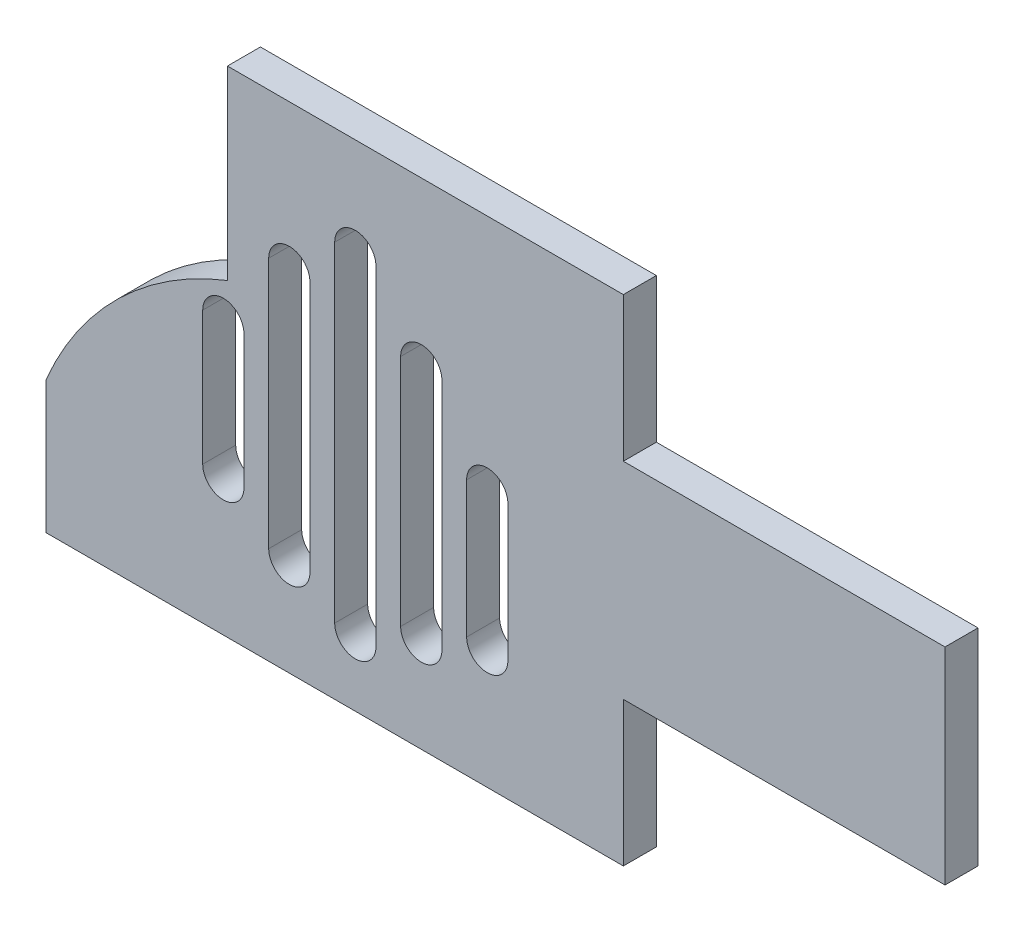
from build123d import *

# Parameters (mm, degrees)
BOSS_EXTRUDE1_DEPTH = 4


with BuildPart() as part:
    # Sketch1 → Boss-Extrude1 (new body)
    with BuildSketch(Plane.XY):
        with BuildLine():
            Line((30.862718171, 33.494054131), (69.862718171, 33.494054131))
            Line((69.862718171, 33.494054131), (69.862718171, 8.494054131))
            Line((69.862718171, 8.494054131), (30.862718171, 8.494054131))
            Line((30.862718171, 8.494054131), (30.862718171, -9.005945869))
            Line((30.862718171, -9.005945869), (-39.137281829, -9.005945869))
            Line((-39.137281829, -9.005945869), (-39.137281829, 7.037446143))
            ThreePointArc((-39.137281829, 7.037446143), (-30.320886371, 19.996051834), (-17.137281829, 28.472304637))
            Line((-17.137281829, 28.472304637), (-17.137281829, 50.994054131))
            Line((-17.137281829, 50.994054131), (30.862718171, 50.994054131))
            Line((30.862718171, 50.994054131), (30.862718171, 33.494054131))
        make_face()
        with BuildLine():
            Line((-4.137281829, 38.994054131), (-4.137281829, -1.005945869))
            ThreePointArc((-4.137281829, -1.005945869), (-1.637281829, -3.505945869), (0.862718171, -1.005945869))
            Line((0.862718171, -1.005945869), (0.862718171, 38.994054131))
            ThreePointArc((0.862718171, 38.994054131), (-1.637281829, 41.494054131), (-4.137281829, 38.994054131))
        make_face(mode=Mode.SUBTRACT)
        with BuildLine():
            Line((-12.137281829, 33.312431903), (-12.137281829, 2.809827896))
            ThreePointArc((-12.137281829, 2.809827896), (-9.637281829, 0.309827896), (-7.137281829, 2.809827896))
            Line((-7.137281829, 2.809827896), (-7.137281829, 33.312431903))
            ThreePointArc((-7.137281829, 33.312431903), (-9.637281829, 35.812431903), (-12.137281829, 33.312431903))
        make_face(mode=Mode.SUBTRACT)
        with BuildLine():
            Line((-15.137281829, 23.861283589), (-15.137281829, 7.683449462))
            ThreePointArc((-15.137281829, 7.683449462), (-17.637281829, 5.183449462), (-20.137281829, 7.683449462))
            Line((-20.137281829, 7.683449462), (-20.137281829, 23.861283589))
            ThreePointArc((-20.137281829, 23.861283589), (-17.637281829, 26.361283589), (-15.137281829, 23.861283589))
        make_face(mode=Mode.SUBTRACT)
        with BuildLine():
            Line((3.862718171, 30.994054131), (3.862718171, 2.647434443))
            ThreePointArc((3.862718171, 2.647434443), (6.362718171, 0.147434443), (8.862718171, 2.647434443))
            Line((8.862718171, 2.647434443), (8.862718171, 30.994054131))
            ThreePointArc((8.862718171, 30.994054131), (6.362718171, 33.494054131), (3.862718171, 30.994054131))
        make_face(mode=Mode.SUBTRACT)
        with BuildLine():
            Line((11.862718171, 22.048271006), (11.862718171, 5.538473012))
            ThreePointArc((11.862718171, 5.538473012), (14.362718171, 3.038473012), (16.862718171, 5.538473012))
            Line((16.862718171, 5.538473012), (16.862718171, 22.048271006))
            ThreePointArc((16.862718171, 22.048271006), (14.362718171, 24.548271006), (11.862718171, 22.048271006))
        make_face(mode=Mode.SUBTRACT)
    extrude(amount=BOSS_EXTRUDE1_DEPTH)


solid = part.part
